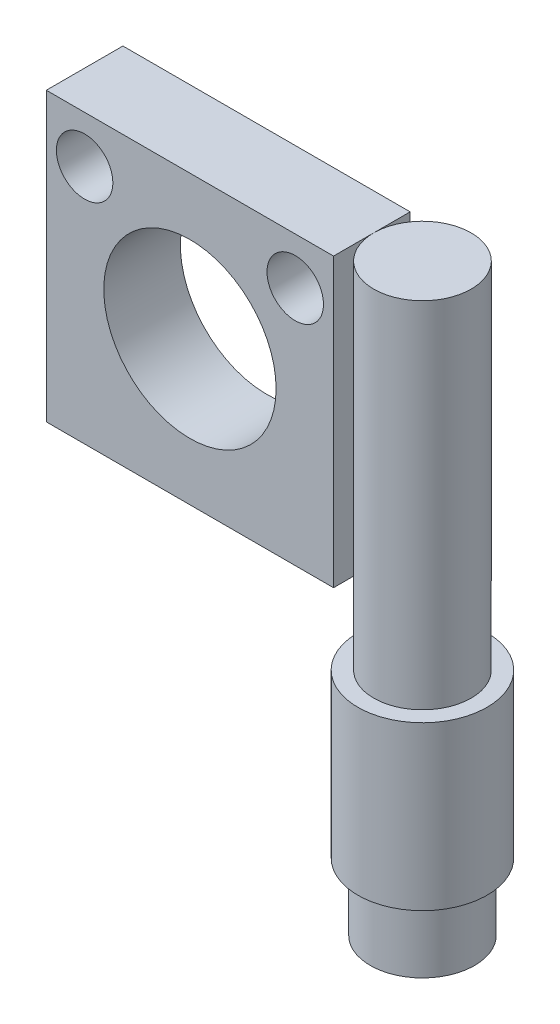
from build123d import *

# Parameters (mm, degrees)
CROQUIS1_W              = 30
CROQUIS1_H              = 30
CROQUIS1_R              = 9
CROQUIS1_R_2            = 2.95
SALIENTE_EXTRUIR2_DEPTH = 8
CROQUIS3_R              = 5.087919121
SALIENTE_EXTRUIR3_DEPTH = 37
CROQUIS4_R              = 6.744773562
SALIENTE_EXTRUIR4_DEPTH = 17
CROQUIS5_R              = 5.451659249
SALIENTE_EXTRUIR5_DEPTH = 7


with BuildPart() as part:
    # Croquis1 → Saliente-Extruir2 (new body)
    with BuildSketch(Plane.XY):
        Rectangle(CROQUIS1_W, CROQUIS1_H)
        Circle(CROQUIS1_R, mode=Mode.SUBTRACT)
        with Locations((-11, 10.1)):
            Circle(CROQUIS1_R_2, mode=Mode.SUBTRACT)
        with Locations(Location((11, 10.1, 0), (0, 0, 180))):
            Circle(CROQUIS1_R_2, mode=Mode.SUBTRACT)
    extrude(amount=SALIENTE_EXTRUIR2_DEPTH)


with BuildPart() as body_2:
    # Croquis3 → Saliente-Extruir3 (new body)
    with BuildSketch(Plane(origin=(0, 15, 0), x_dir=(1, 0, 0), z_dir=(0, 1, 0))):
        with Locations(Location((20.087919121, -3.80242042, 0), (0, 0, 270))):
            Circle(CROQUIS3_R)
    extrude(amount=-SALIENTE_EXTRUIR3_DEPTH)

    # Croquis4 → Saliente-Extruir4 (add)
    with BuildSketch(Plane.XZ.offset(22)):
        with Locations(Location((20.087919121, 3.80242042, 0), (0, 0, 270))):
            Circle(CROQUIS4_R)
    extrude(amount=SALIENTE_EXTRUIR4_DEPTH)

    # Croquis5 → Saliente-Extruir5 (add)
    with BuildSketch(Plane.XZ.offset(39)):
        with Locations(Location((20.087919121, 3.80242042, 0), (0, 0, 270))):
            Circle(CROQUIS5_R)
    extrude(amount=SALIENTE_EXTRUIR5_DEPTH)


solid = Compound([part.part, body_2.part])
